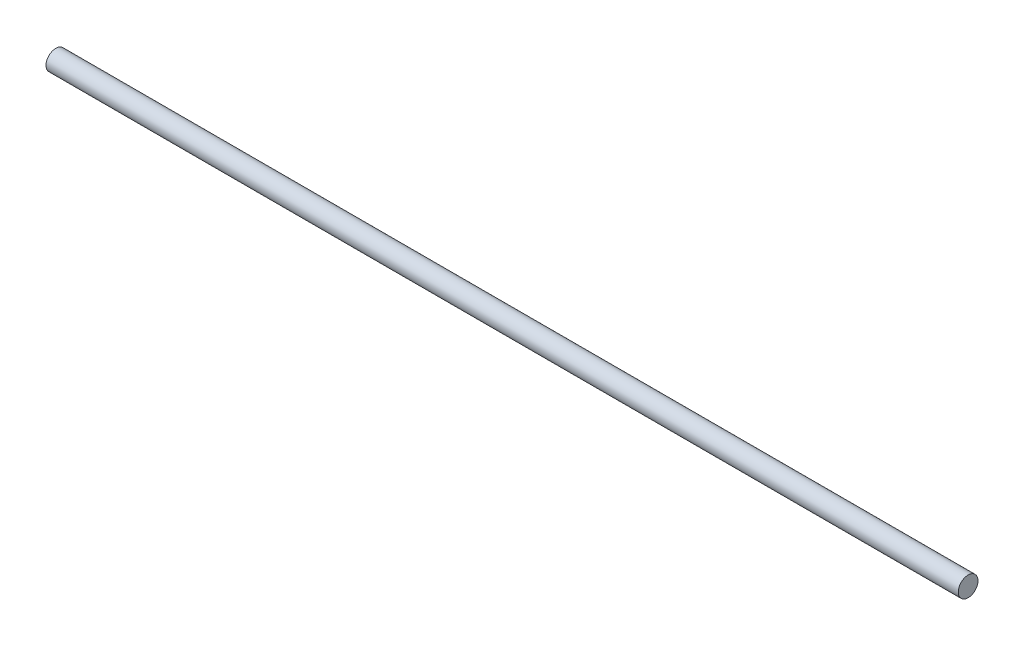
from build123d import *

# Parameters (mm, degrees)
SKETCH_1_R      = 4
EXTRUDE_1_DEPTH = 370


with BuildPart() as part:
    # 草图1 → 凸台-拉伸1 (new body)
    with BuildSketch(Plane(origin=(0, 0, 0), x_dir=(0, 0, -1), z_dir=(1, 0, 0))):
        Circle(SKETCH_1_R)
    extrude(amount=EXTRUDE_1_DEPTH)


solid = part.part
